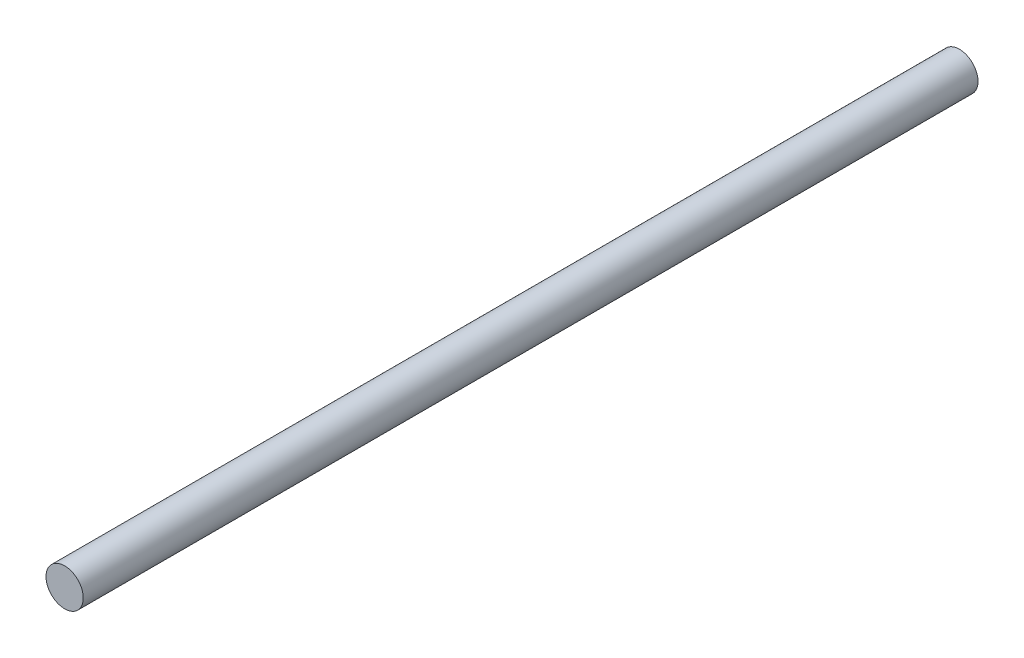
from build123d import *

# Parameters (mm, degrees)
SKETCH1_R           = 3.175
BOSS_EXTRUDE1_DEPTH = 152.4


with BuildPart() as part:
    # Sketch1 → Boss-Extrude1 (new body)
    with BuildSketch(Plane.XY):
        with Locations(Location((0, 0, 0), (0, 0, 180))):
            Circle(SKETCH1_R)
    extrude(amount=BOSS_EXTRUDE1_DEPTH)


solid = part.part
